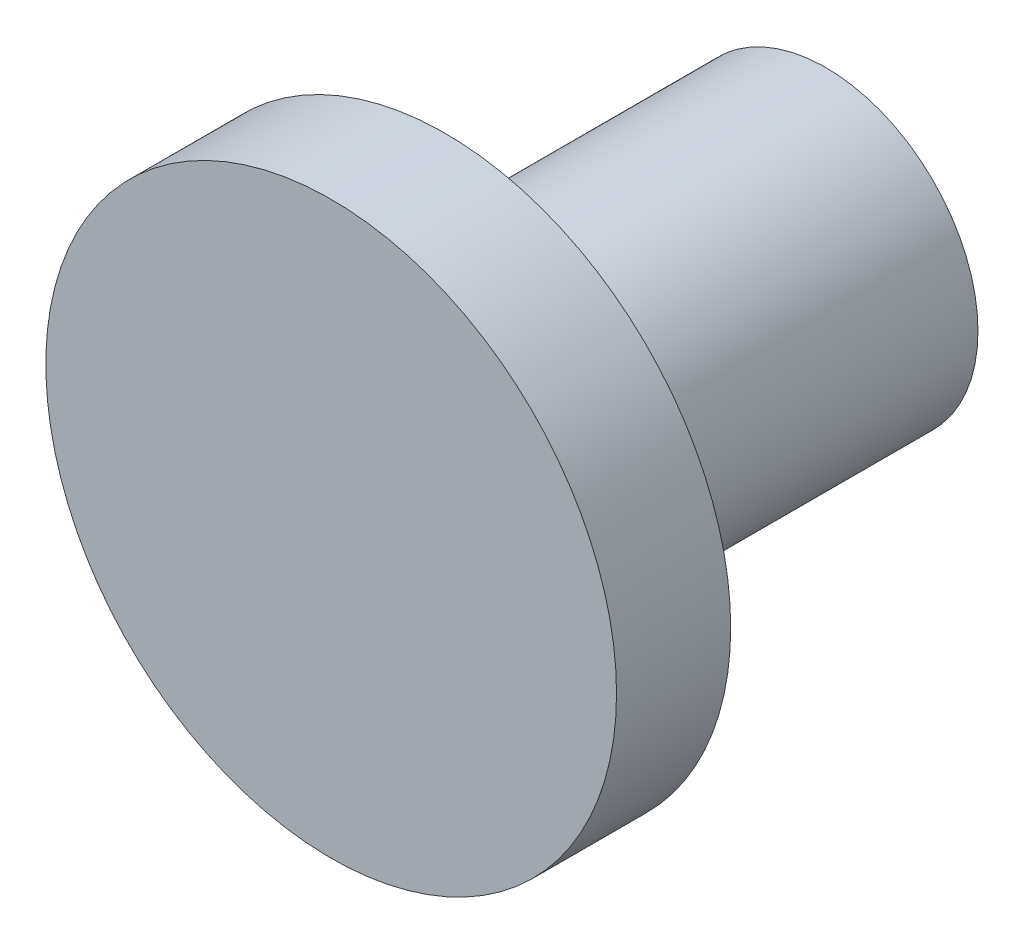
from build123d import *

# Parameters (mm, degrees)
SKETCH1_R           = 4
BOSS_EXTRUDE1_DEPTH = 10
SKETCH2_R           = 7.5
BOSS_EXTRUDE2_DEPTH = 3
SKETCH3_R           = 1.25
CUT_EXTRUDE1_DEPTH  = 10


with BuildPart() as part:
    # Sketch1 → Boss-Extrude1 (new body)
    with BuildSketch(Plane.XY):
        Circle(SKETCH1_R)
    extrude(amount=BOSS_EXTRUDE1_DEPTH)

    # Sketch2 → Boss-Extrude2 (add)
    with BuildSketch(Plane.XY.offset(10)):
        Circle(SKETCH2_R)
    extrude(amount=BOSS_EXTRUDE2_DEPTH)

    # Sketch3 → Cut-Extrude1 (cut)
    with BuildSketch(Plane(origin=(0, 0, 0), x_dir=(-1, 0, 0), z_dir=(0, 0, -1))):
        Circle(SKETCH3_R)
    extrude(amount=-CUT_EXTRUDE1_DEPTH, mode=Mode.SUBTRACT)


solid = part.part
